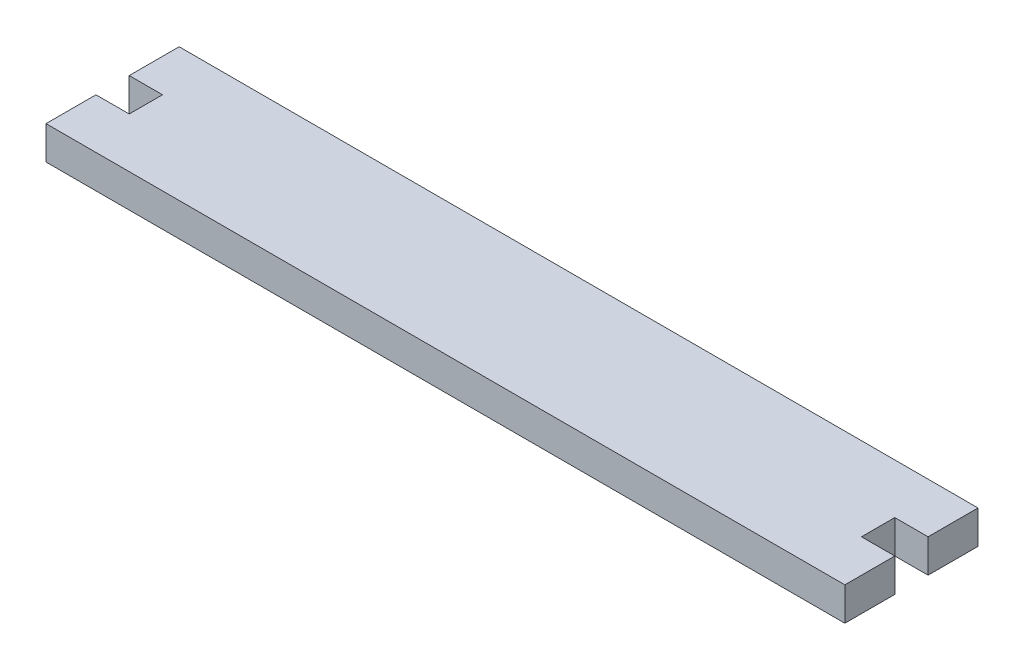
from build123d import *

# Parameters (mm, degrees)
BOSS_EXTRUDE1_DEPTH = 3.175


with BuildPart() as part:
    # Sketch1 → Boss-Extrude1 (new body)
    with BuildSketch(Plane(origin=(0, 0, 0), x_dir=(1, 0, 0), z_dir=(0, 1, 0))):
        Polygon((-38.1, 6.35), (-38.1, 1.5875), (-34.925, 1.5875), (-34.925, -1.5875), (-38.1, -1.5875), (-38.1, -6.35), (38.1, -6.35), (38.1, -1.5875), (34.925, -1.5875), (34.925, 1.5875), (38.1, 1.5875), (38.1, 6.35), align=None)
    extrude(amount=BOSS_EXTRUDE1_DEPTH)


solid = part.part
